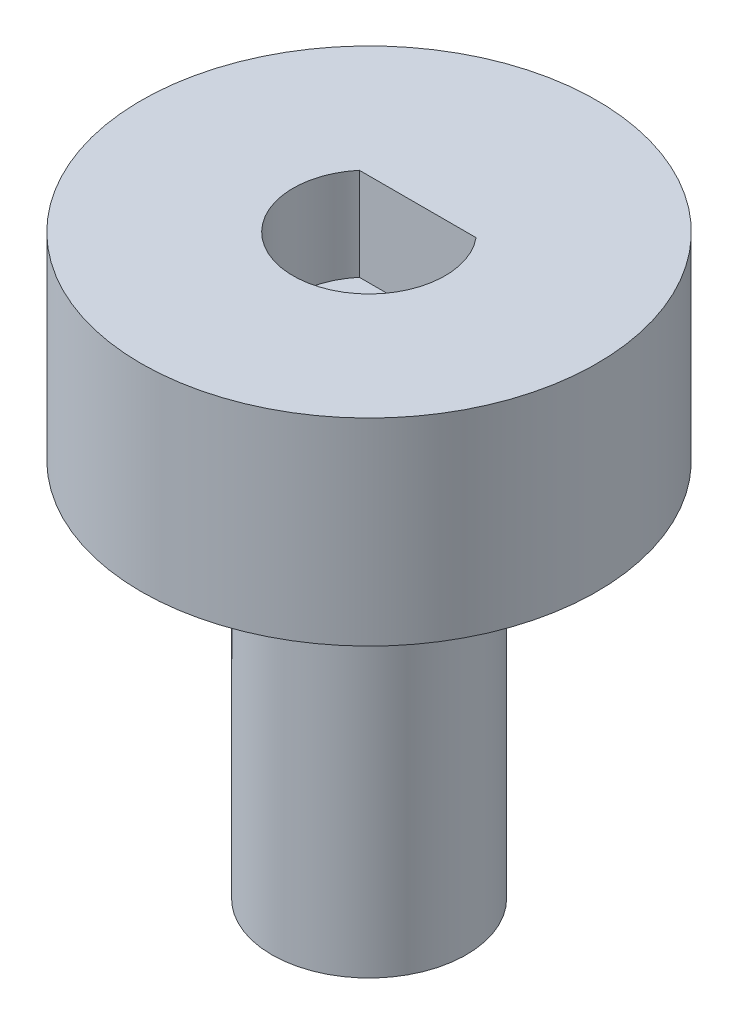
from build123d import *

# Parameters (mm, degrees)
SKETCH2_R           = 4.066
BOSS_EXTRUDE1_DEPTH = 15.875
SKETCH3_R           = 9.525
BOSS_EXTRUDE2_DEPTH = 8.255
CUT_EXTRUDE1_DEPTH  = 3.875


with BuildPart() as part:
    # Sketch2 → Boss-Extrude1 (new body)
    with BuildSketch(Plane(origin=(0, 0, 0), x_dir=(1, 0, 0), z_dir=(0, 1, 0))):
        with Locations(Location((0, 0, 0), (0, 0, 270))):
            Circle(SKETCH2_R)
    extrude(amount=BOSS_EXTRUDE1_DEPTH)

    # Sketch3 → Boss-Extrude2 (add)
    with BuildSketch(Plane(origin=(0, 15.875, 0), x_dir=(1, 0, 0), z_dir=(0, 1, 0))):
        with Locations(Location((0, 0, 0), (0, 0, 270))):
            Circle(SKETCH3_R)
    extrude(amount=BOSS_EXTRUDE2_DEPTH)

    # Sketch4 → Cut-Extrude1 (cut)
    with BuildSketch(Plane(origin=(0, 24.13, 0), x_dir=(1, 0, 0), z_dir=(0, 1, 0))):
        with BuildLine():
            Line((-2.439590334, 2.032), (2.439590334, 2.032))
            ThreePointArc((2.439590334, 2.032), (0, -3.175), (-2.439590334, 2.032))
        make_face()
    extrude(amount=-CUT_EXTRUDE1_DEPTH, mode=Mode.SUBTRACT)


solid = part.part
